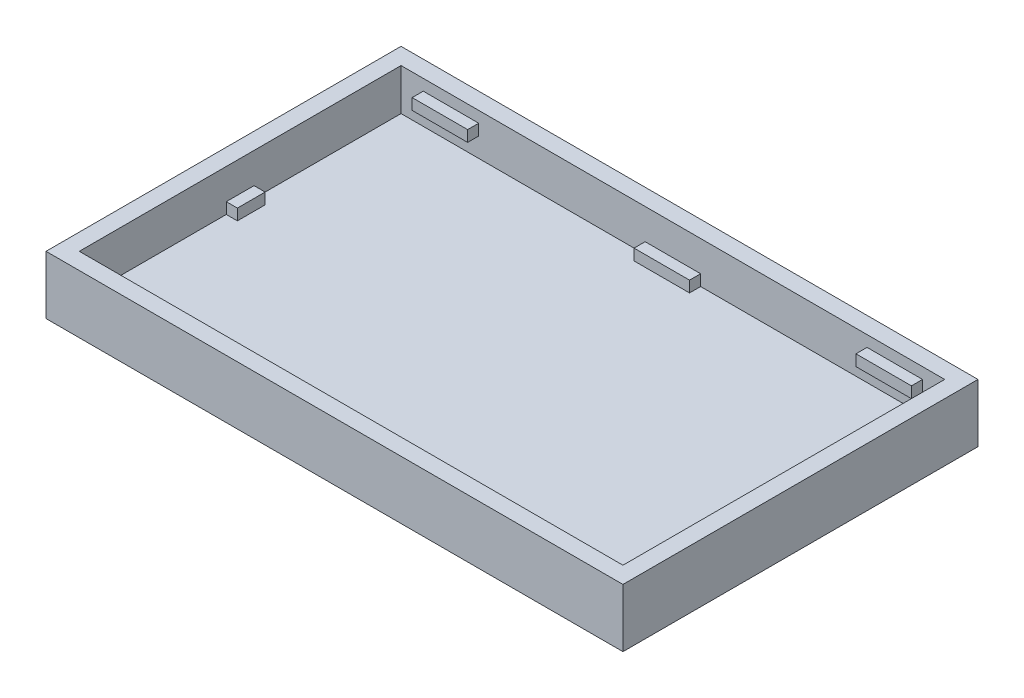
from build123d import *

# Parameters (mm, degrees)
SKETCH_1_W      = 104
SKETCH_1_H      = 64
SKETCH_1_W_2    = 98
SKETCH_1_H_2    = 58
EXTRUDE_1_DEPTH = 2
SKETCH_1_3_W    = 104
SKETCH_1_3_H    = 64
EXTRUDE_2_DEPTH = 3
SKETCH_2_W      = 2
SKETCH_2_H      = 5
SKETCH_2_W_2    = 10
SKETCH_2_H_2    = 2
EXTRUDE_3_DEPTH = 2
EXTRUDE_START   = 2
SKETCH_1_4_W    = 104
SKETCH_1_4_H    = 64
SKETCH_1_4_W_2  = 98
SKETCH_1_4_H_2  = 58
EXTRUDE_4_DEPTH = 3.5
SKETCH_3_W      = 10
SKETCH_3_H      = 2
EXTRUDE_5_DEPTH = 2
EXTRUDE_START_2 = 5.5
SKETCH_1_5_W    = 104
SKETCH_1_5_H    = 64
SKETCH_1_5_W_2  = 98
SKETCH_1_5_H_2  = 58
EXTRUDE_6_DEPTH = 2


with BuildPart() as part:
    # 草图1 → 凸台-拉伸1 (new body)
    with BuildSketch(Plane(origin=(0, 0, 0), x_dir=(1, 0, 0), z_dir=(0, 1, 0))):
        Rectangle(SKETCH_1_W, SKETCH_1_H)
        Rectangle(SKETCH_1_W_2, SKETCH_1_H_2, mode=Mode.SUBTRACT)
    extrude(amount=EXTRUDE_1_DEPTH)

    # 草图1<3> → 凸台-拉伸2 (add)
    with BuildSketch(Plane(origin=(0, 0, 0), x_dir=(1, 0, 0), z_dir=(0, 1, 0))):
        Rectangle(SKETCH_1_3_W, SKETCH_1_3_H)
    extrude(amount=-EXTRUDE_2_DEPTH)

    # 草图2 → 凸台-拉伸3 (add)
    with BuildSketch(Plane(origin=(0, 0, 0), x_dir=(1, 0, 0), z_dir=(0, 1, 0))):
        with Locations((-48, 0)):
            Rectangle(SKETCH_2_W, SKETCH_2_H)
        with Locations((48, 0)):
            Rectangle(SKETCH_2_W, SKETCH_2_H)
        with Locations((0, 28)):
            Rectangle(SKETCH_2_W_2, SKETCH_2_H_2)
        with Locations((0, -28)):
            Rectangle(SKETCH_2_W_2, SKETCH_2_H_2)
    extrude(amount=EXTRUDE_3_DEPTH)

    # 草图1<4> → 凸台-拉伸4 (add)
    with BuildSketch(Plane(origin=(0, 0, 0), x_dir=(1, 0, 0), z_dir=(0, 1, 0)).offset(EXTRUDE_START)):
        Rectangle(SKETCH_1_4_W, SKETCH_1_4_H)
        Rectangle(SKETCH_1_4_W_2, SKETCH_1_4_H_2, mode=Mode.SUBTRACT)
    extrude(amount=EXTRUDE_4_DEPTH)

    # 草图3 → 凸台-拉伸5 (add)
    with BuildSketch(Plane(origin=(0, 5.5, 0), x_dir=(1, 0, 0), z_dir=(0, 1, 0))):
        with Locations((40, -28)):
            Rectangle(SKETCH_3_W, SKETCH_3_H)
        with Locations((-40, -28)):
            Rectangle(SKETCH_3_W, SKETCH_3_H)
        with Locations((40, 28)):
            Rectangle(SKETCH_3_W, SKETCH_3_H)
        with Locations((-40, 28)):
            Rectangle(SKETCH_3_W, SKETCH_3_H)
    extrude(amount=-EXTRUDE_5_DEPTH)

    # 草图1<5> → 凸台-拉伸6 (add)
    with BuildSketch(Plane(origin=(0, 0, 0), x_dir=(1, 0, 0), z_dir=(0, 1, 0)).offset(EXTRUDE_START_2)):
        Rectangle(SKETCH_1_5_W, SKETCH_1_5_H)
        Rectangle(SKETCH_1_5_W_2, SKETCH_1_5_H_2, mode=Mode.SUBTRACT)
    extrude(amount=EXTRUDE_6_DEPTH)


solid = part.part
